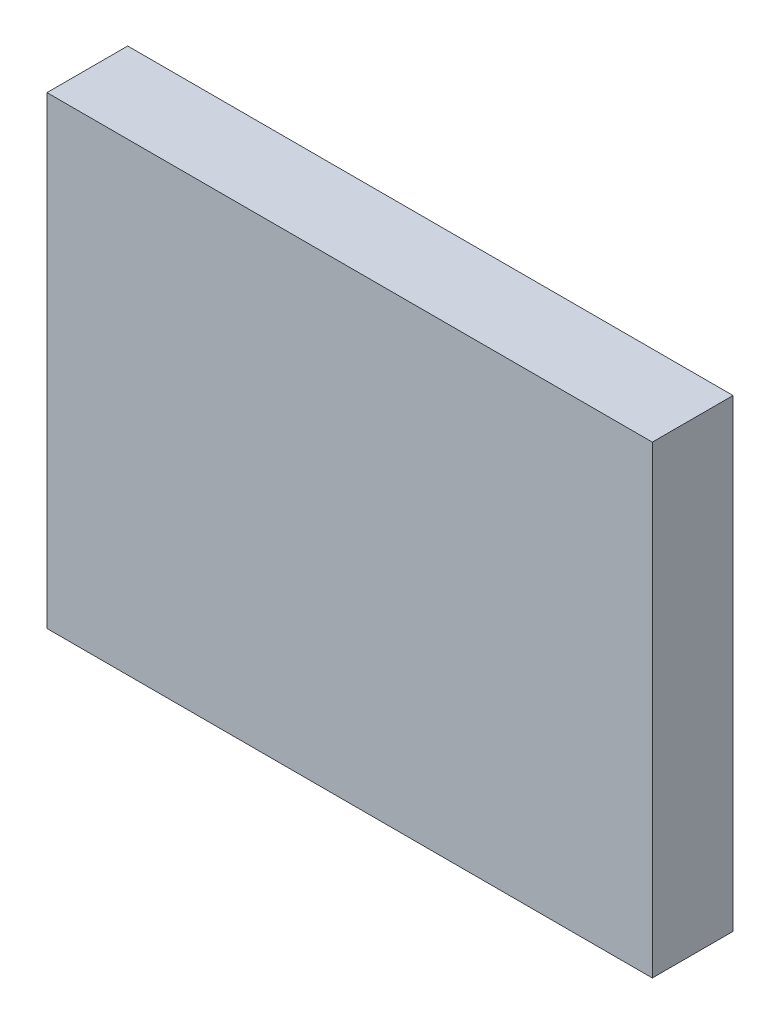
from build123d import *

# Parameters (mm, degrees)
ESBO_O1_W                = 15
ESBO_O1_H                = 11.5
RESSALTO_EXTRUS_O1_DEPTH = 2


with BuildPart() as part:
    # Esboço1 → Ressalto-extrusão1 (new body)
    with BuildSketch(Plane.XY):
        with Locations((0.851955307, -0.079608939)):
            Rectangle(ESBO_O1_W, ESBO_O1_H)
    extrude(amount=RESSALTO_EXTRUS_O1_DEPTH)


solid = part.part
